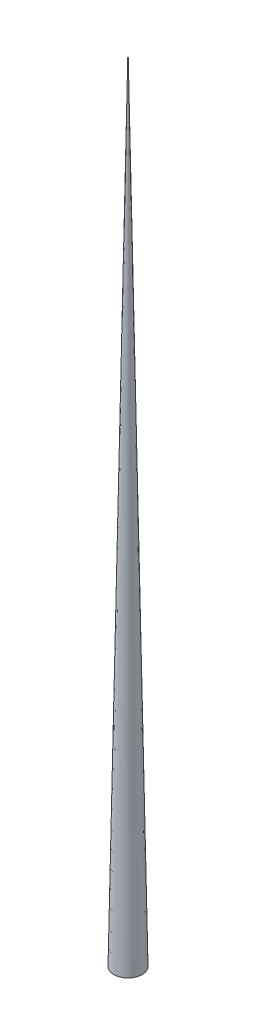
from build123d import *


with BuildPart() as part:
    # Sketch2 → Revolve1 (revolve)
    with BuildSketch(Plane(origin=(0, 0, 0), x_dir=(0, 0, -1), z_dir=(1, 0, 0))):
        Polygon((0, 0), (0, -228.6), (4.064, -228.6), align=None)
    revolve(axis=Axis((0, 0, 0), (0, -1, 0)))


solid = part.part
